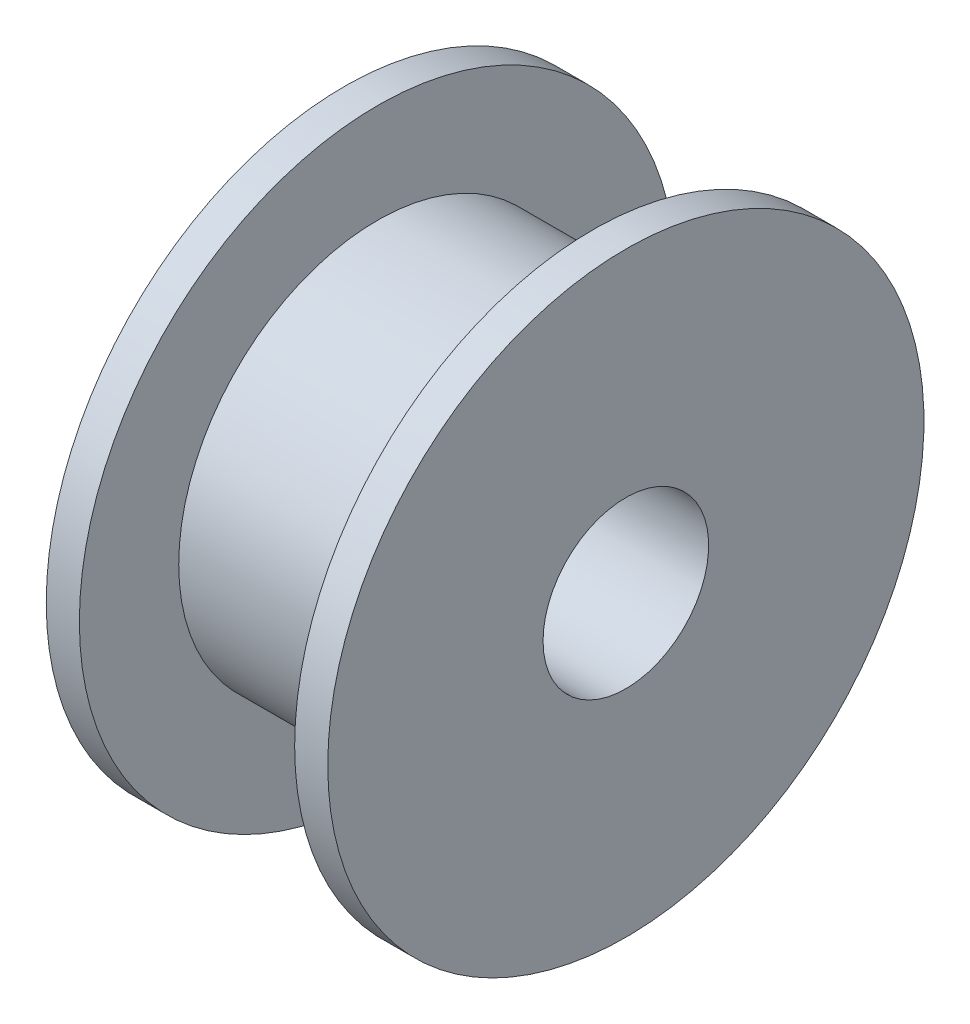
from build123d import *


with BuildPart() as part:
    # MainSketch → MainRevolve (revolve)
    with BuildSketch(Plane.XY, mode=Mode.PRIVATE) as mainrevolve_sk:
        Polygon((-4.25, 2.5), (4.25, 2.5), (4.25, 9), (3.25, 9), (3.25, 6), (-3.25, 6), (-3.25, 9), (-4.25, 9), align=None)
    revolve(mainrevolve_sk.sketch.rotate(Axis((-4.25, 0, 0), (1, 0, 0)), 90), axis=Axis((-4.25, 0, 0), (1, 0, 0)))


solid = part.part
